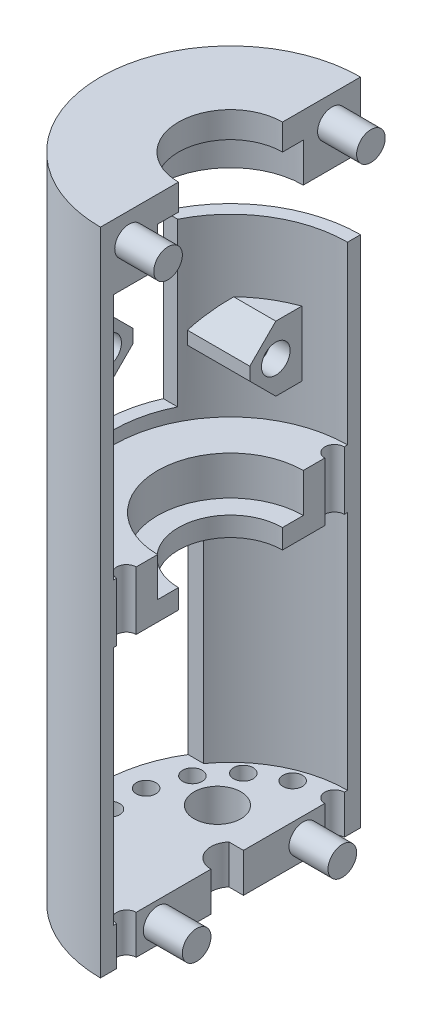
from build123d import *

# Parameters (mm, degrees)
SKETCH_1_R               = 10
EXTRUDE_1_DEPTH          = 3
CUT_EXTRUDE_1_REACH      = 16.457
SKETCH_2_R               = 0.75
SKETCH_3_R               = 10
SKETCH_3_R_2             = 9
EXTRUDE_2_DEPTH          = 47
CUT_EXTRUDE_START        = -50
CUT_EXTRUDE_2_DEPTH      = 50
EXTRUDE_START            = -23
EXTRUDE_5_DEPTH          = 3
EXTRUDE_START_2          = 1.5
EXTRUDE_6_DEPTH          = 1.5
EXTRUDE_START_3          = -2
EXTRUDE_7_DEPTH          = 2
EXTRUDE_START_4          = 3
EXTRUDE_8_DEPTH          = 3
SKETCH_13_R              = 0.75
CUT_EXTRUDE_5_DEPTH      = 30.597297174
CUT_EXTRUDE_6_REACH      = 53.962
CUT_EXTRUDE_6_END_RADIUS = 10
SKETCH_14_W              = 9.625
SKETCH_14_H              = 18.5
CUT_EXTRUDE_7_REACH      = 53.962
CUT_EXTRUDE_7_END_RADIUS = 10
SKETCH_16_R              = 1.1
EXTRUDE_9_DEPTH          = 3
BOSS_EXTRUDE1_DEPTH      = 5
BOSS_EXTRUDE2_START      = -5
BOSS_EXTRUDE2_DEPTH      = 5
SKETCH3_R                = 1.1
CUT_EXTRUDE1_DEPTH       = 1.5
CHAMFER1_SIZE            = 2
CUT_EXTRUDE2_REACH       = 53.962
SKETCH4_R                = 1.8


with BuildPart() as part:
    # 草图1 → 凸台-拉伸1 (new body)
    with BuildSketch(Plane(origin=(0, 0, 0), x_dir=(1, 0, 0), z_dir=(0, 1, 0))):
        with Locations(Location((0, 0, 0), (0, 0, 270))):
            Circle(SKETCH_1_R)
        with BuildLine():
            Line((1.118033989, 1), (-1.118033989, 1))
            ThreePointArc((-1.118033989, 1), (0, -1.5), (1.118033989, 1))
        make_face(mode=Mode.SUBTRACT)
    extrude(amount=EXTRUDE_1_DEPTH)

    # 草图2 → 切除-拉伸1 (cut, up to next)
    with BuildSketch(Plane(origin=(0, 3, 0), x_dir=(1, 0, 0), z_dir=(0, 1, 0)), mode=Mode.PRIVATE) as cut_extrude_1_sk1:
        with Locations(Location((0, 8, 0), (0, 0, 270))):
            Circle(SKETCH_2_R)
    cut_extrude_1_tool1 = extrude(cut_extrude_1_sk1.sketch, amount=-CUT_EXTRUDE_1_REACH, mode=Mode.PRIVATE) & part.part
    # 草图2 → 切除-拉伸1 (cut, up to next)
    with BuildSketch(Plane(origin=(0, 3, 0), x_dir=(1, 0, 0), z_dir=(0, 1, 0)), mode=Mode.PRIVATE) as cut_extrude_1_sk2:
        with Locations(Location((2.736161147, 7.517540966, 0), (0, 0, 270))):
            Circle(SKETCH_2_R)
    cut_extrude_1_tool2 = extrude(cut_extrude_1_sk2.sketch, amount=-CUT_EXTRUDE_1_REACH, mode=Mode.PRIVATE) & part.part
    # 草图2 → 切除-拉伸1 (cut, up to next)
    with BuildSketch(Plane(origin=(0, 3, 0), x_dir=(1, 0, 0), z_dir=(0, 1, 0)), mode=Mode.PRIVATE) as cut_extrude_1_sk3:
        with Locations(Location((5.142300877, 6.128355545, 0), (0, 0, 270))):
            Circle(SKETCH_2_R)
    cut_extrude_1_tool3 = extrude(cut_extrude_1_sk3.sketch, amount=-CUT_EXTRUDE_1_REACH, mode=Mode.PRIVATE) & part.part
    # 草图2 → 切除-拉伸1 (cut, up to next)
    with BuildSketch(Plane(origin=(0, 3, 0), x_dir=(1, 0, 0), z_dir=(0, 1, 0)), mode=Mode.PRIVATE) as cut_extrude_1_sk4:
        with Locations(Location((6.92820323, 4, 0), (0, 0, 270))):
            Circle(SKETCH_2_R)
    cut_extrude_1_tool4 = extrude(cut_extrude_1_sk4.sketch, amount=-CUT_EXTRUDE_1_REACH, mode=Mode.PRIVATE) & part.part
    # 草图2 → 切除-拉伸1 (cut, up to next)
    with BuildSketch(Plane(origin=(0, 3, 0), x_dir=(1, 0, 0), z_dir=(0, 1, 0)), mode=Mode.PRIVATE) as cut_extrude_1_sk5:
        with Locations(Location((7.878462024, 1.389185421, 0), (0, 0, 270))):
            Circle(SKETCH_2_R)
    cut_extrude_1_tool5 = extrude(cut_extrude_1_sk5.sketch, amount=-CUT_EXTRUDE_1_REACH, mode=Mode.PRIVATE) & part.part
    # 草图2 → 切除-拉伸1 (cut, up to next)
    with BuildSketch(Plane(origin=(0, 3, 0), x_dir=(1, 0, 0), z_dir=(0, 1, 0)), mode=Mode.PRIVATE) as cut_extrude_1_sk6:
        with Locations(Location((7.878462024, -1.389185421, 0), (0, 0, 270))):
            Circle(SKETCH_2_R)
    cut_extrude_1_tool6 = extrude(cut_extrude_1_sk6.sketch, amount=-CUT_EXTRUDE_1_REACH, mode=Mode.PRIVATE) & part.part
    # 草图2 → 切除-拉伸1 (cut, up to next)
    with BuildSketch(Plane(origin=(0, 3, 0), x_dir=(1, 0, 0), z_dir=(0, 1, 0)), mode=Mode.PRIVATE) as cut_extrude_1_sk7:
        with Locations(Location((6.92820323, -4, 0), (0, 0, 270))):
            Circle(SKETCH_2_R)
    cut_extrude_1_tool7 = extrude(cut_extrude_1_sk7.sketch, amount=-CUT_EXTRUDE_1_REACH, mode=Mode.PRIVATE) & part.part
    # 草图2 → 切除-拉伸1 (cut, up to next)
    with BuildSketch(Plane(origin=(0, 3, 0), x_dir=(1, 0, 0), z_dir=(0, 1, 0)), mode=Mode.PRIVATE) as cut_extrude_1_sk8:
        with Locations(Location((5.142300877, -6.128355545, 0), (0, 0, 270))):
            Circle(SKETCH_2_R)
    cut_extrude_1_tool8 = extrude(cut_extrude_1_sk8.sketch, amount=-CUT_EXTRUDE_1_REACH, mode=Mode.PRIVATE) & part.part
    # 草图2 → 切除-拉伸1 (cut, up to next)
    with BuildSketch(Plane(origin=(0, 3, 0), x_dir=(1, 0, 0), z_dir=(0, 1, 0)), mode=Mode.PRIVATE) as cut_extrude_1_sk9:
        with Locations(Location((2.736161147, -7.517540966, 0), (0, 0, 270))):
            Circle(SKETCH_2_R)
    cut_extrude_1_tool9 = extrude(cut_extrude_1_sk9.sketch, amount=-CUT_EXTRUDE_1_REACH, mode=Mode.PRIVATE) & part.part
    # 草图2 → 切除-拉伸1 (cut, up to next)
    with BuildSketch(Plane(origin=(0, 3, 0), x_dir=(1, 0, 0), z_dir=(0, 1, 0)), mode=Mode.PRIVATE) as cut_extrude_1_sk10:
        with Locations(Location((0, -8, 0), (0, 0, 270))):
            Circle(SKETCH_2_R)
    cut_extrude_1_tool10 = extrude(cut_extrude_1_sk10.sketch, amount=-CUT_EXTRUDE_1_REACH, mode=Mode.PRIVATE) & part.part
    # 草图2 → 切除-拉伸1 (cut, up to next)
    with BuildSketch(Plane(origin=(0, 3, 0), x_dir=(1, 0, 0), z_dir=(0, 1, 0)), mode=Mode.PRIVATE) as cut_extrude_1_sk11:
        with Locations(Location((-2.736161147, -7.517540966, 0), (0, 0, 270))):
            Circle(SKETCH_2_R)
    cut_extrude_1_tool11 = extrude(cut_extrude_1_sk11.sketch, amount=-CUT_EXTRUDE_1_REACH, mode=Mode.PRIVATE) & part.part
    # 草图2 → 切除-拉伸1 (cut, up to next)
    with BuildSketch(Plane(origin=(0, 3, 0), x_dir=(1, 0, 0), z_dir=(0, 1, 0)), mode=Mode.PRIVATE) as cut_extrude_1_sk12:
        with Locations(Location((-5.142300877, -6.128355545, 0), (0, 0, 270))):
            Circle(SKETCH_2_R)
    cut_extrude_1_tool12 = extrude(cut_extrude_1_sk12.sketch, amount=-CUT_EXTRUDE_1_REACH, mode=Mode.PRIVATE) & part.part
    # 草图2 → 切除-拉伸1 (cut, up to next)
    with BuildSketch(Plane(origin=(0, 3, 0), x_dir=(1, 0, 0), z_dir=(0, 1, 0)), mode=Mode.PRIVATE) as cut_extrude_1_sk13:
        with Locations(Location((-6.92820323, -4, 0), (0, 0, 270))):
            Circle(SKETCH_2_R)
    cut_extrude_1_tool13 = extrude(cut_extrude_1_sk13.sketch, amount=-CUT_EXTRUDE_1_REACH, mode=Mode.PRIVATE) & part.part
    # 草图2 → 切除-拉伸1 (cut, up to next)
    with BuildSketch(Plane(origin=(0, 3, 0), x_dir=(1, 0, 0), z_dir=(0, 1, 0)), mode=Mode.PRIVATE) as cut_extrude_1_sk14:
        with Locations(Location((-7.878462024, -1.389185421, 0), (0, 0, 270))):
            Circle(SKETCH_2_R)
    cut_extrude_1_tool14 = extrude(cut_extrude_1_sk14.sketch, amount=-CUT_EXTRUDE_1_REACH, mode=Mode.PRIVATE) & part.part
    # 草图2 → 切除-拉伸1 (cut, up to next)
    with BuildSketch(Plane(origin=(0, 3, 0), x_dir=(1, 0, 0), z_dir=(0, 1, 0)), mode=Mode.PRIVATE) as cut_extrude_1_sk15:
        with Locations(Location((-7.878462024, 1.389185421, 0), (0, 0, 270))):
            Circle(SKETCH_2_R)
    cut_extrude_1_tool15 = extrude(cut_extrude_1_sk15.sketch, amount=-CUT_EXTRUDE_1_REACH, mode=Mode.PRIVATE) & part.part
    # 草图2 → 切除-拉伸1 (cut, up to next)
    with BuildSketch(Plane(origin=(0, 3, 0), x_dir=(1, 0, 0), z_dir=(0, 1, 0)), mode=Mode.PRIVATE) as cut_extrude_1_sk16:
        with Locations(Location((-6.92820323, 4, 0), (0, 0, 270))):
            Circle(SKETCH_2_R)
    cut_extrude_1_tool16 = extrude(cut_extrude_1_sk16.sketch, amount=-CUT_EXTRUDE_1_REACH, mode=Mode.PRIVATE) & part.part
    # 草图2 → 切除-拉伸1 (cut, up to next)
    with BuildSketch(Plane(origin=(0, 3, 0), x_dir=(1, 0, 0), z_dir=(0, 1, 0)), mode=Mode.PRIVATE) as cut_extrude_1_sk17:
        with Locations(Location((-5.142300877, 6.128355545, 0), (0, 0, 270))):
            Circle(SKETCH_2_R)
    cut_extrude_1_tool17 = extrude(cut_extrude_1_sk17.sketch, amount=-CUT_EXTRUDE_1_REACH, mode=Mode.PRIVATE) & part.part
    # 草图2 → 切除-拉伸1 (cut, up to next)
    with BuildSketch(Plane(origin=(0, 3, 0), x_dir=(1, 0, 0), z_dir=(0, 1, 0)), mode=Mode.PRIVATE) as cut_extrude_1_sk18:
        with Locations(Location((-2.736161147, 7.517540966, 0), (0, 0, 270))):
            Circle(SKETCH_2_R)
    cut_extrude_1_tool18 = extrude(cut_extrude_1_sk18.sketch, amount=-CUT_EXTRUDE_1_REACH, mode=Mode.PRIVATE) & part.part
    add(cut_extrude_1_tool1.solids().sort_by_distance((0, 3, -8))[0], mode=Mode.SUBTRACT)
    add(cut_extrude_1_tool2.solids().sort_by_distance((2.736161, 3, -7.517541))[0], mode=Mode.SUBTRACT)
    add(cut_extrude_1_tool3.solids().sort_by_distance((5.142301, 3, -6.128356))[0], mode=Mode.SUBTRACT)
    add(cut_extrude_1_tool4.solids().sort_by_distance((6.928203, 3, -4))[0], mode=Mode.SUBTRACT)
    add(cut_extrude_1_tool5.solids().sort_by_distance((7.878462, 3, -1.389185))[0], mode=Mode.SUBTRACT)
    add(cut_extrude_1_tool6.solids().sort_by_distance((7.878462, 3, 1.389185))[0], mode=Mode.SUBTRACT)
    add(cut_extrude_1_tool7.solids().sort_by_distance((6.928203, 3, 4))[0], mode=Mode.SUBTRACT)
    add(cut_extrude_1_tool8.solids().sort_by_distance((5.142301, 3, 6.128356))[0], mode=Mode.SUBTRACT)
    add(cut_extrude_1_tool9.solids().sort_by_distance((2.736161, 3, 7.517541))[0], mode=Mode.SUBTRACT)
    add(cut_extrude_1_tool10.solids().sort_by_distance((0, 3, 8))[0], mode=Mode.SUBTRACT)
    add(cut_extrude_1_tool11.solids().sort_by_distance((-2.736161, 3, 7.517541))[0], mode=Mode.SUBTRACT)
    add(cut_extrude_1_tool12.solids().sort_by_distance((-5.142301, 3, 6.128356))[0], mode=Mode.SUBTRACT)
    add(cut_extrude_1_tool13.solids().sort_by_distance((-6.928203, 3, 4))[0], mode=Mode.SUBTRACT)
    add(cut_extrude_1_tool14.solids().sort_by_distance((-7.878462, 3, 1.389185))[0], mode=Mode.SUBTRACT)
    add(cut_extrude_1_tool15.solids().sort_by_distance((-7.878462, 3, -1.389185))[0], mode=Mode.SUBTRACT)
    add(cut_extrude_1_tool16.solids().sort_by_distance((-6.928203, 3, -4))[0], mode=Mode.SUBTRACT)
    add(cut_extrude_1_tool17.solids().sort_by_distance((-5.142301, 3, -6.128356))[0], mode=Mode.SUBTRACT)
    add(cut_extrude_1_tool18.solids().sort_by_distance((-2.736161, 3, -7.517541))[0], mode=Mode.SUBTRACT)

    # 草图3 → 凸台-拉伸2 (add)
    with BuildSketch(Plane(origin=(0, 3, 0), x_dir=(1, 0, 0), z_dir=(0, 1, 0))):
        with Locations(Location((0, 0, 0), (0, 0, 270))):
            Circle(SKETCH_3_R)
        with Locations(Location((0, 0, 0), (0, 0, 270))):
            Circle(SKETCH_3_R_2, mode=Mode.SUBTRACT)
    extrude(amount=EXTRUDE_2_DEPTH)

    # 草图4 → 切除-拉伸2 (cut)
    with BuildSketch(Plane(origin=(0, 50, 0), x_dir=(1, 0, 0), z_dir=(0, 1, 0)).offset(CUT_EXTRUDE_START)):
        with BuildLine():
            Line((0, -10), (0, 10))
            ThreePointArc((0, 10), (10, 0), (0, -10))
        make_face()
    extrude(amount=CUT_EXTRUDE_2_DEPTH, mode=Mode.SUBTRACT)

    # 草图9 → 凸台-拉伸5 (add)
    with BuildSketch(Plane.XZ.offset(EXTRUDE_START)):
        with BuildLine():
            Line((0, 9), (0, 5.6))
            ThreePointArc((0, 5.6), (-5.6, 0), (0, -5.6))
            Line((0, -5.6), (0, -9))
            ThreePointArc((0, -9), (-9, 0), (0, 9))
        make_face()
    extrude(amount=-EXTRUDE_5_DEPTH)

    # 草图10 → 凸台-拉伸6 (add)
    with BuildSketch(Plane.XZ.offset(-23).offset(EXTRUDE_START_2)):
        with BuildLine():
            Line((0, 9), (0, 4))
            ThreePointArc((0, 4), (-4, 0), (0, -4))
            Line((0, -4), (0, -9))
            ThreePointArc((0, -9), (-9, 0), (0, 9))
        make_face()
    extrude(amount=-EXTRUDE_6_DEPTH)

    # 草图11 → 凸台-拉伸7 (add)
    with BuildSketch(Plane(origin=(0, 50, 0), x_dir=(1, 0, 0), z_dir=(0, 1, 0)).offset(EXTRUDE_START_3)):
        with BuildLine():
            Line((0, -9), (0, -4))
            ThreePointArc((0, -4), (-4, 0), (0, 4))
            Line((0, 4), (0, 9))
            ThreePointArc((0, 9), (-9, 0), (0, -9))
        make_face()
    extrude(amount=EXTRUDE_7_DEPTH)

    # 草图12 → 凸台-拉伸8 (add)
    with BuildSketch(Plane.XZ.offset(-48).offset(EXTRUDE_START_4)):
        with BuildLine():
            Line((0, 9), (0, 5.6))
            ThreePointArc((0, 5.6), (-5.6, 0), (0, -5.6))
            Line((0, -5.6), (0, -9))
            ThreePointArc((0, -9), (-9, 0), (0, 9))
        make_face()
    extrude(amount=-EXTRUDE_8_DEPTH)

    # 草图13 → 切除-拉伸5 (cut, through all)
    with BuildSketch(Plane(origin=(0, 26, 0), x_dir=(1, 0, 0), z_dir=(0, 1, 0))):
        with Locations((0, 8)):
            Circle(SKETCH_13_R)
        with Locations((0, -8)):
            Circle(SKETCH_13_R)
    extrude(amount=-CUT_EXTRUDE_5_DEPTH, mode=Mode.SUBTRACT)

    # 切除-拉伸6: up to this cylinder (the profile starts inside it)
    cut_extrude_6_end = Plane(origin=(0, 12.25, 0), z_dir=(0, -1, 0)) * Cylinder(CUT_EXTRUDE_6_END_RADIUS, 128.924, mode=Mode.PRIVATE)
    # 草图14 → 切除-拉伸6 (cut, up to the surface)
    with BuildSketch(Plane(origin=(0, 0, 0), x_dir=(0, 0, -1), z_dir=(1, 0, 0)), mode=Mode.PRIVATE) as cut_extrude_6_sk1:
        with Locations((0.4375, 12.25)):
            Rectangle(SKETCH_14_W, SKETCH_14_H)
    cut_extrude_6_tool1 = extrude(cut_extrude_6_sk1.sketch, amount=-CUT_EXTRUDE_6_REACH, mode=Mode.PRIVATE) & cut_extrude_6_end
    add(cut_extrude_6_tool1.solids().sort_by_distance((0, 12.25, -0.4375))[0], mode=Mode.SUBTRACT)

    # 切除-拉伸7: up to this cylinder (the profile starts inside it)
    cut_extrude_7_end = Plane(origin=(0, 37.165254, 0), z_dir=(0, -1, 0)) * Cylinder(CUT_EXTRUDE_7_END_RADIUS, 128.924, mode=Mode.PRIVATE)
    # 草图15 → 切除-拉伸7 (cut, up to the surface)
    with BuildSketch(Plane(origin=(0, 0, 0), x_dir=(0, 0, -1), z_dir=(1, 0, 0)), mode=Mode.PRIVATE) as cut_extrude_7_sk1:
        Polygon((3.637279597, 45), (-4, 45), (-4, 27), (4, 27), (4, 39.5), (10, 39.5), (10, 45), align=None)
    cut_extrude_7_tool1 = extrude(cut_extrude_7_sk1.sketch, amount=-CUT_EXTRUDE_7_REACH, mode=Mode.PRIVATE) & cut_extrude_7_end
    add(cut_extrude_7_tool1.solids().sort_by_distance((0, 37.165254, -1.305085))[0], mode=Mode.SUBTRACT)

    # 草图16 → 凸台-拉伸9 (add)
    with BuildSketch(Plane(origin=(0, 0, 0), x_dir=(0, 0, -1), z_dir=(1, 0, 0))):
        with Locations(Location((-7.8, 48, 0), (0, 0, 180))):
            Circle(SKETCH_16_R)
        with Locations(Location((7.8, 48, 0), (0, 0, 180))):
            Circle(SKETCH_16_R)
        with Locations(Location((-5.6, 1.5, 0), (0, 0, 180))):
            Circle(SKETCH_16_R)
        with Locations(Location((5.6, 1.5, 0), (0, 0, 180))):
            Circle(SKETCH_16_R)
    extrude(amount=EXTRUDE_9_DEPTH)

    # Sketch1 → Boss-Extrude1 (add)
    with BuildSketch(Plane(origin=(0, 29, 0), x_dir=(1, 0, 0), z_dir=(0, 1, 0))):
        with BuildLine():
            Line((-3, 4.485281374), (-7.802707927, 4.485281374))
            ThreePointArc((-7.802707927, 4.485281374), (-5.759741716, 6.9155893), (-3, 8.485281374))
            Line((-3, 8.485281374), (-3, 4.485281374))
        make_face()
    extrude(amount=BOSS_EXTRUDE1_DEPTH)

    # Sketch2 → Boss-Extrude2 (add)
    with BuildSketch(Plane(origin=(0, 41, 0), x_dir=(1, 0, 0), z_dir=(0, 1, 0)).offset(BOSS_EXTRUDE2_START)):
        with BuildLine():
            Line((-3, -4.485281374), (-7.802707927, -4.485281374))
            ThreePointArc((-7.802707927, -4.485281374), (-5.759741716, -6.9155893), (-3, -8.485281374))
            Line((-3, -8.485281374), (-3, -4.485281374))
        make_face()
    extrude(amount=BOSS_EXTRUDE2_DEPTH)

    # Sketch3 → Cut-Extrude1 (cut)
    with BuildSketch(Plane(origin=(-3, 0, 0), x_dir=(0, 0, -1), z_dir=(1, 0, 0))):
        with Locations((-6.485281374, 38.5)):
            Circle(SKETCH3_R)
        with Locations((6.485281374, 31.5)):
            Circle(SKETCH3_R)
    extrude(amount=-CUT_EXTRUDE1_DEPTH, mode=Mode.SUBTRACT)

    # Chamfer1
    chamfer1_edges = [part.edges().sort_by_distance(p)[0] for p in [
        (-5.401353963, 29, -4.485281374),
        (-5.401353963, 34, -4.485281374),
        (-5.401353963, 36, 4.485281374),
        (-5.401353963, 41, 4.485281374),
    ]]
    chamfer(chamfer1_edges, length=CHAMFER1_SIZE)

    # Sketch4 → Cut-Extrude2 (cut, up to next)
    with BuildSketch(Plane.XZ, mode=Mode.PRIVATE) as cut_extrude2_sk1:
        with Locations(Location((-4, -3, 0), (0, 0, 270))):
            Circle(SKETCH4_R)
    cut_extrude2_tool1 = extrude(cut_extrude2_sk1.sketch, amount=-CUT_EXTRUDE2_REACH, mode=Mode.PRIVATE) & part.part
    add(cut_extrude2_tool1.solids().sort_by_distance((-4, 0, -3))[0], mode=Mode.SUBTRACT)


solid = part.part
